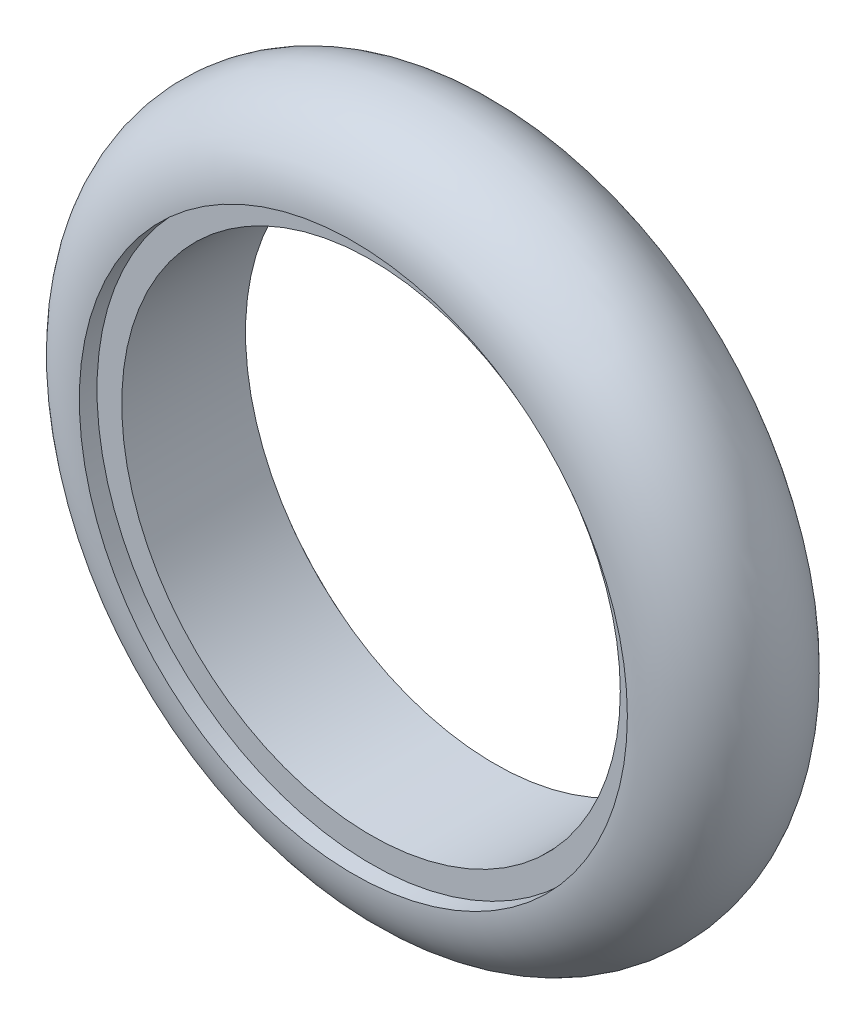
from build123d import *


with BuildPart() as part:
    # Sketch2 → Revolve1 (revolve)
    with BuildSketch(Plane(origin=(0, 0, 0), x_dir=(0, 0, -1), z_dir=(1, 0, 0)), mode=Mode.PRIVATE) as revolve1_sk:
        with BuildLine():
            Line((-22.5, 77.5), (-17.5, 77.5))
            Line((-17.5, 77.5), (-17.5, 70.5))
            Line((-17.5, 70.5), (17.5, 70.5))
            Line((17.5, 70.5), (17.5, 77.5))
            Line((17.5, 77.5), (22.5, 77.5))
            ThreePointArc((22.5, 77.5), (0, 100), (-22.5, 77.5))
        make_face()
    revolve(revolve1_sk.sketch.rotate(Axis((0, 0, 0), (0, 0, -1)), 90), axis=Axis((0, 0, 0), (0, 0, -1)))


solid = part.part
